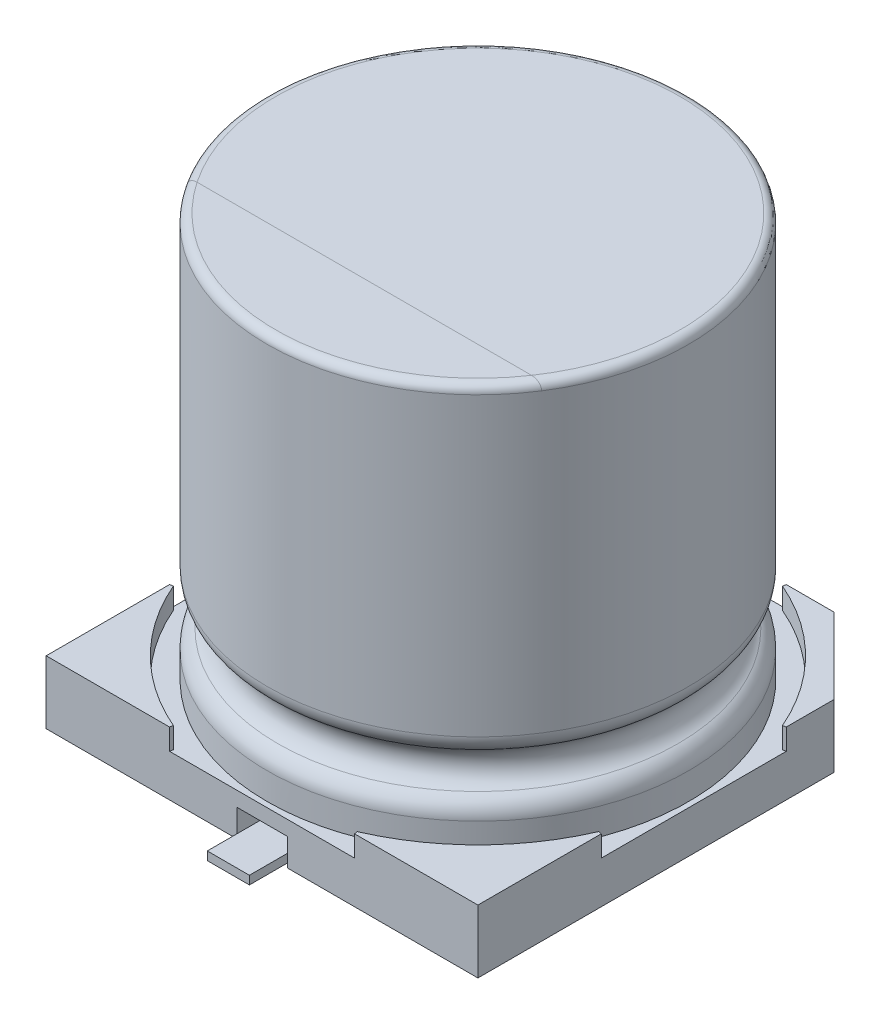
from build123d import *
from OCP.BRepFilletAPI import BRepFilletAPI_MakeChamfer

# Parameters (mm, degrees)
SKETCH1_W                = 10.25
SKETCH1_H                = 10.25
BOSS_EXTRUDE1_DEPTH      = 1
SKETCH2_R                = 5
BOSS_EXTRUDE2_DEPTH      = 9.6
BOSS_EXTRUDE3_DEPTH      = 0.5
SKETCH3_R                = 0.5
FILLET1_R                = 0.5
FILLET2_R                = 0.2
CHAMFER1_SIZE            = 1.8
SKETCH4_W                = 1.2
SKETCH4_H                = 1.2
CUT_EXTRUDE1_DEPTH       = 0.65
EXTRUDE_THIN1_DEPTH      = 0.5
EXTRUDE_THIN1_DEPTH_BACK = 0.5
SKETCH6_W                = 2
SKETCH6_H                = 0.2
CHAMFER2_SIZE            = 0.200841177
CHAMFER2_SIZE2           = 0.2
CHAMFER2_SIZE_2          = 0.2
CHAMFER2_SIZE2_2         = 0.200841177


with BuildPart() as part:
    # Sketch1 → Boss-Extrude1 (new body)
    with BuildSketch(Plane(origin=(0, 0, 0), x_dir=(1, 0, 0), z_dir=(0, 1, 0))):
        Rectangle(SKETCH1_W, SKETCH1_H)
    extrude(amount=BOSS_EXTRUDE1_DEPTH)

    # Sketch5 → Boss-Extrude3 (add)
    with BuildSketch(Plane(origin=(0, 1, 0), x_dir=(1, 0, 0), z_dir=(0, 1, 0))):
        with BuildLine():
            Line((-5.125, -1.996089928), (-5.125, -5.125))
            Line((-5.125, -5.125), (-1.996089928, -5.125))
            ThreePointArc((-1.996089928, -5.125), (-3.889087297, -3.889087297), (-5.125, -1.996089928))
        make_face()
        with BuildLine():
            Line((-5.125, 5.125), (-1.996089928, 5.125))
            ThreePointArc((-1.996089928, 5.125), (-3.889087297, 3.889087297), (-5.125, 1.996089928))
            Line((-5.125, 1.996089928), (-5.125, 5.125))
        make_face()
        with BuildLine():
            Line((5.125, 5.125), (5.125, 1.996089928))
            ThreePointArc((5.125, 1.996089928), (3.889087297, 3.889087297), (1.996089928, 5.125))
            Line((1.996089928, 5.125), (5.125, 5.125))
        make_face()
        with BuildLine():
            Line((5.125, -1.996089928), (5.125, -5.125))
            Line((5.125, -5.125), (1.996089928, -5.125))
            ThreePointArc((1.996089928, -5.125), (3.889087297, -3.889087297), (5.125, -1.996089928))
        make_face()
    extrude(amount=BOSS_EXTRUDE3_DEPTH)

    # Chamfer1
    chamfer1_edges = [part.edges().sort_by_distance(p)[0] for p in [
        (-5.125, 0.75, -5.125),
        (5.125, 0.75, -5.125),
    ]]
    chamfer(chamfer1_edges, length=CHAMFER1_SIZE)

    # Sketch4 → Cut-Extrude1 (cut)
    with BuildSketch(Plane.XZ):
        with Locations((0, 4.525)):
            Rectangle(SKETCH4_W, SKETCH4_H)
        with Locations((0, -4.525)):
            Rectangle(SKETCH4_W, SKETCH4_H)
    extrude(amount=-CUT_EXTRUDE1_DEPTH, mode=Mode.SUBTRACT)

    # Chamfer2: one chamfer whose edges measure the first distance from different faces: ONE call of the kernel's chamfer builder (chamfer() names one face for all edges)
    chamfer2_edges_1 = [part.edges().sort_by_distance(p)[0] for p in [
        (-5.125, 1.25, -1.996089928),
    ]]
    chamfer2_side_1 = [part.faces().sort_by_distance(p)[0] for p in [
        (-3.889087297, 1.25, -3.889087297),
    ]]
    chamfer2_edges_2 = [part.edges().sort_by_distance(p)[0] for p in [
        (-1.996089928, 1.25, -5.125),
        (1.996089928, 1.25, -5.125),
    ]]
    chamfer2_side_2 = [part.faces().sort_by_distance(p)[0] for p in [
        (0, 0.657410294, -5.125),
    ]]
    chamfer2_edges_3 = [part.edges().sort_by_distance(p)[0] for p in [
        (1.996089928, 1.25, 5.125),
        (-1.996089928, 1.25, 5.125),
    ]]
    chamfer2_side_3 = [part.faces().sort_by_distance(p)[0] for p in [
        (0, 0.69709503, 5.125),
    ]]
    chamfer2_edges_4 = [part.edges().sort_by_distance(p)[0] for p in [
        (5.125, 1.25, 1.996089928),
    ]]
    chamfer2_side_4 = [part.faces().sort_by_distance(p)[0] for p in [
        (5.125, 0.656540559, 1.068226993),
    ]]
    chamfer2_edges_5 = [part.edges().sort_by_distance(p)[0] for p in [
        (-5.125, 1.25, 1.996089928),
    ]]
    chamfer2_side_5 = [part.faces().sort_by_distance(p)[0] for p in [
        (-5.125, 0.656540559, 1.068226993),
    ]]
    chamfer2_edges_6 = [part.edges().sort_by_distance(p)[0] for p in [
        (5.125, 1.25, -1.996089928),
    ]]
    chamfer2_side_6 = [part.faces().sort_by_distance(p)[0] for p in [
        (3.889087297, 1.25, -3.889087297),
    ]]
    chamfer2 = BRepFilletAPI_MakeChamfer(part.part.solid().wrapped)
    for e in chamfer2_edges_1:
        chamfer2.Add(CHAMFER2_SIZE, CHAMFER2_SIZE2, e.wrapped, chamfer2_side_1[0].wrapped)  # the first distance lies on this face
    for e in chamfer2_edges_2:
        chamfer2.Add(CHAMFER2_SIZE_2, CHAMFER2_SIZE2_2, e.wrapped, chamfer2_side_2[0].wrapped)  # the first distance lies on this face
    for e in chamfer2_edges_3:
        chamfer2.Add(CHAMFER2_SIZE_2, CHAMFER2_SIZE2_2, e.wrapped, chamfer2_side_3[0].wrapped)  # the first distance lies on this face
    for e in chamfer2_edges_4:
        chamfer2.Add(CHAMFER2_SIZE_2, CHAMFER2_SIZE2_2, e.wrapped, chamfer2_side_4[0].wrapped)  # the first distance lies on this face
    for e in chamfer2_edges_5:
        chamfer2.Add(CHAMFER2_SIZE_2, CHAMFER2_SIZE2_2, e.wrapped, chamfer2_side_5[0].wrapped)  # the first distance lies on this face
    for e in chamfer2_edges_6:
        chamfer2.Add(CHAMFER2_SIZE_2, CHAMFER2_SIZE2_2, e.wrapped, chamfer2_side_6[0].wrapped)  # the first distance lies on this face
    add(Compound.cast(chamfer2.Shape()), mode=Mode.REPLACE)


with BuildPart() as body_2:
    # Sketch2 → Boss-Extrude2 (new body)
    with BuildSketch(Plane(origin=(0, 1, 0), x_dir=(1, 0, 0), z_dir=(0, 1, 0))):
        with Locations(Location((0, 0, 0), (0, 0, 270))):
            Circle(SKETCH2_R)
    extrude(amount=BOSS_EXTRUDE2_DEPTH)

    # Sketch3 → Cut-Revolve1 (revolve, cut)
    with BuildSketch(Plane.XY, mode=Mode.PRIVATE) as cut_revolve1_sk:
        with Locations((5, 2.5)):
            Circle(SKETCH3_R)
    revolve(cut_revolve1_sk.sketch.rotate(Axis((0, 10.6, 0), (0, -1, 0)), 90), axis=Axis((0, 10.6, 0), (0, -1, 0)), mode=Mode.SUBTRACT)

    # Fillet1
    fillet1_edges = [body_2.edges().sort_by_distance(p)[0] for p in [
        (0, 3, -5),
        (0, 2, -5),
    ]]
    fillet(fillet1_edges, radius=FILLET1_R)

    # Fillet2
    fillet2_edges = [body_2.edges().sort_by_distance(p)[0] for p in [
        (0, 10.6, -5),
    ]]
    fillet(fillet2_edges, radius=FILLET2_R)


with BuildPart() as body_3:
    # Sketch6 → Extrude-Thin1 (new, two sides: drawn at the far end of the back side and taken through both)
    with BuildSketch(Plane(origin=(0, 0, 0), x_dir=(0, 0, -1), z_dir=(1, 0, 0)).offset(-EXTRUDE_THIN1_DEPTH_BACK)):
        with Locations((-4.925, 0.1)):
            Rectangle(SKETCH6_W, SKETCH6_H)
    extrude(amount=EXTRUDE_THIN1_DEPTH + EXTRUDE_THIN1_DEPTH_BACK)


with BuildPart() as body_4:
    # Mirror3: mirrored copy
    add(body_3.part.mirror(Plane.XY))


solid = Compound([part.part, body_2.part, body_3.part, body_4.part])
